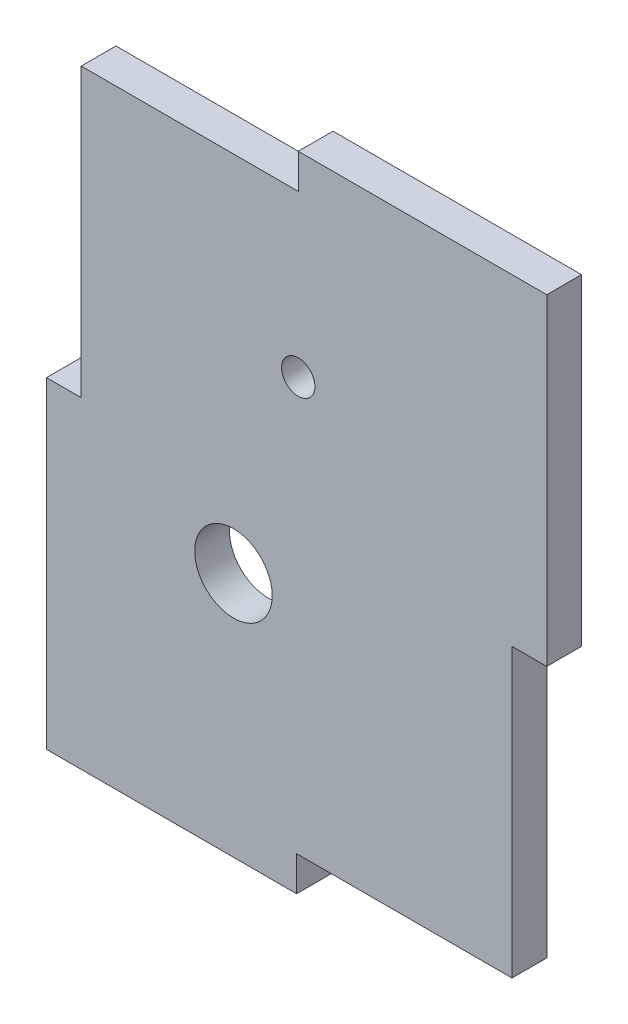
from build123d import *

# Parameters (mm, degrees)
BACKSKETCH_R        = 3.429
BACKSKETCH_R_2      = 1.4732
BOSS_EXTRUDE1_DEPTH = 3.0734


with BuildPart() as part:
    # backSketch → Boss-Extrude1 (new body)
    with BuildSketch(Plane.XY):
        Polygon((0, 50.8), (0, 25.4), (-3.0734, 25.4), (-3.0734, -3.0734), (19.05, -3.0734), (19.05, 0), (38.1, 0), (38.1, 25.4), (41.1734, 25.4), (41.1734, 53.8734), (19.196716748, 53.8734), (19.196716748, 50.8), align=None)
        with Locations((13.465150567, 18.677705992)):
            Circle(BACKSKETCH_R, mode=Mode.SUBTRACT)
        with Locations((19.196716748, 36.578509469)):
            Circle(BACKSKETCH_R_2, mode=Mode.SUBTRACT)
    extrude(amount=BOSS_EXTRUDE1_DEPTH)


solid = part.part
